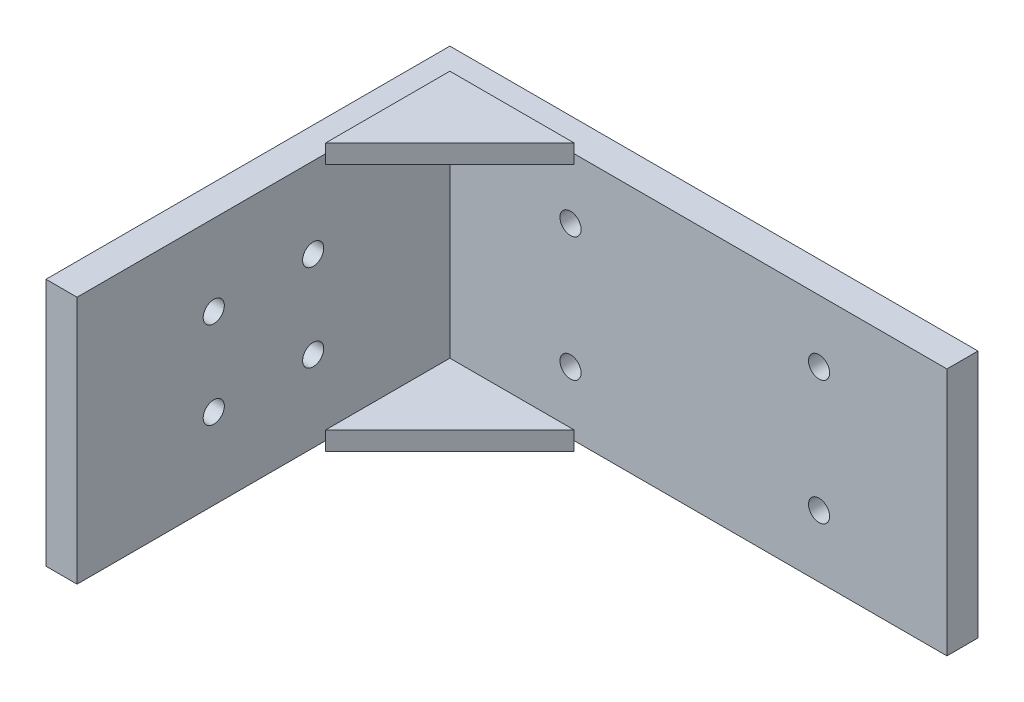
from build123d import *

# Parameters (mm, degrees)
SKETCH_1_W          = 80
SKETCH_1_H          = 40
SKETCH_1_R          = 1.7
EXTRUDE_1_DEPTH     = 5
SKETCH_4_W          = 65
SKETCH_4_H          = 40.004466265
EXTRUDE_4_DEPTH     = 5
SKETCH_5_R          = 1.7
CUT_EXTRUDE_1_DEPTH = 10
EXTRUDE_6_DEPTH     = 1.5
EXTRUDE_7_DEPTH     = 1.5


with BuildPart() as part:
    # 草图1 → 凸台-拉伸1 (new body)
    with BuildSketch(Plane.XY):
        with Locations((40, -20)):
            Rectangle(SKETCH_1_W, SKETCH_1_H)
        with Locations((19.418738728, -30)):
            Circle(SKETCH_1_R, mode=Mode.SUBTRACT)
        with Locations((59.418738728, -30)):
            Circle(SKETCH_1_R, mode=Mode.SUBTRACT)
        with BuildLine():
            ThreePointArc((21.118738728, -10), (20.620820256, -11.202081528), (19.418738728, -11.7))
            ThreePointArc((19.418738728, -11.7), (18.2166572, -8.797918472), (21.118738728, -10))
        make_face(mode=Mode.SUBTRACT)
        with Locations((59.418738728, -10)):
            Circle(SKETCH_1_R, mode=Mode.SUBTRACT)
    extrude(amount=EXTRUDE_1_DEPTH)

    # 草图4 → 凸台-拉伸4 (add)
    with BuildSketch(Plane.ZY):
        with Locations((32.5, -20.002233133)):
            Rectangle(SKETCH_4_W, SKETCH_4_H)
    extrude(amount=EXTRUDE_4_DEPTH)

    # 草图5 → 切除-拉伸1 (cut)
    with BuildSketch(Plane(origin=(0, 0, 0), x_dir=(0, 0, -1), z_dir=(1, 0, 0))):
        with Locations((-43, -13.002233132)):
            Circle(SKETCH_5_R)
        with Locations((-27, -13.002233132)):
            Circle(SKETCH_5_R)
        with Locations((-27, -27.002233132)):
            Circle(SKETCH_5_R)
        with Locations((-43, -27.002233132)):
            Circle(SKETCH_5_R)
    extrude(amount=-CUT_EXTRUDE_1_DEPTH, mode=Mode.SUBTRACT)

    # 草图8 → 凸台-拉伸7 (add, symmetric)
    with BuildSketch(Plane.XZ.offset(40)):
        Polygon((0, 5), (20, 5), (0, 25), align=None)
    extrude(amount=EXTRUDE_7_DEPTH, both=True)


with BuildPart() as body_2:
    # 草图6 → 凸台-拉伸6 (new, symmetric)
    with BuildSketch(Plane(origin=(0, 0, 0), x_dir=(1, 0, 0), z_dir=(0, 1, 0))):
        Polygon((0, -5), (20, -5), (0, -25), align=None)
    extrude(amount=EXTRUDE_6_DEPTH, both=True)


solid = Compound([part.part, body_2.part])
